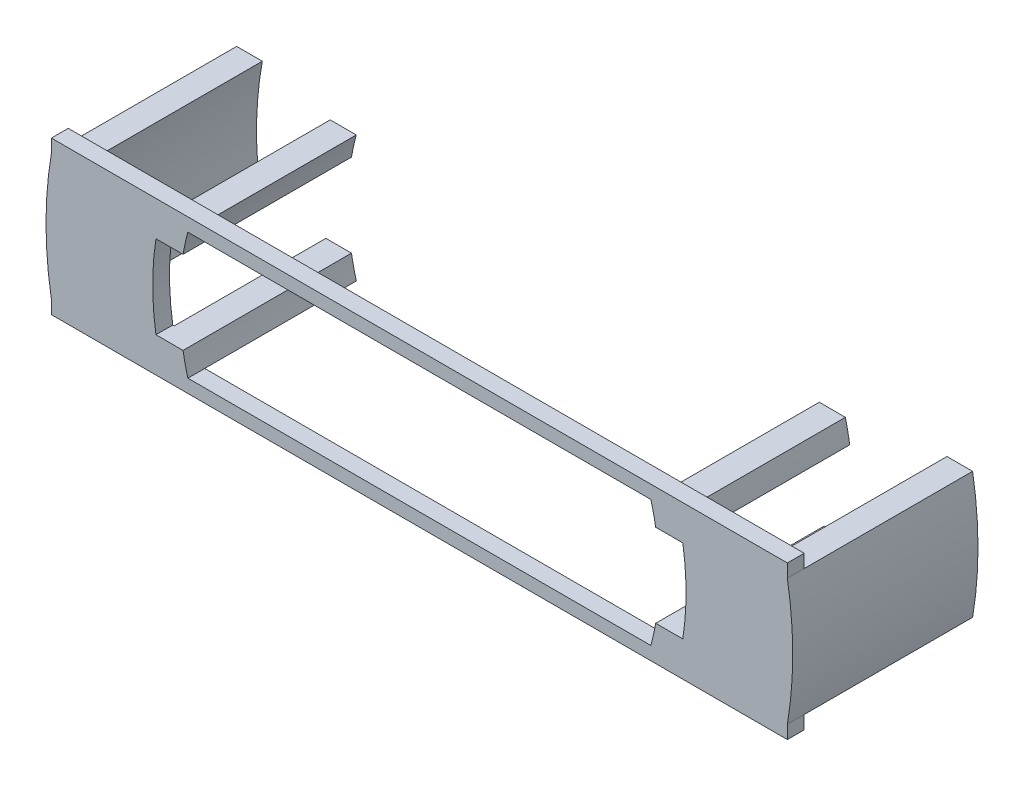
from build123d import *

# Parameters (mm, degrees)
BOSS_EXTRUDE1_DEPTH        = 2.54
BOSS_EXTRUDE1_DEPTH_BACK   = 25.4
BOSS_EXTRUDE1_2_DEPTH      = 2.54
BOSS_EXTRUDE1_2_DEPTH_BACK = 25.4
CUT_EXTRUDE1_DEPTH         = 38.1
SKETCH5_R                  = 52.5
SKETCH5_R_2                = 40
CUT_EXTRUDE2_DEPTH         = 63.505162797
SKETCH6_W                  = 110.993636282
SKETCH6_H                  = 2.54
BOSS_EXTRUDE2_DEPTH        = 2
SKETCH7_W                  = 110.993636282
SKETCH7_H                  = 2.54
BOSS_EXTRUDE3_DEPTH        = 2
SKETCH8_W                  = 85.612929722
SKETCH8_H                  = 41.20835684
CUT_EXTRUDE4_DEPTH         = 2.54


with BuildPart() as part:
    # Sketch1 → Boss-Extrude1 (new, two sides: drawn at the far end of the back side and taken through both)
    with BuildSketch(Plane.XY.offset(-BOSS_EXTRUDE1_DEPTH_BACK)):
        with BuildLine():
            Line((-55.496818141, -9.53516), (-34.911270727, -9.53516))
            ThreePointArc((-34.911270727, -9.53516), (-36.19, 0), (-34.911270727, 9.53516))
            Line((-34.911270727, 9.53516), (-55.496818141, 9.53516))
            ThreePointArc((-55.496818141, 9.53516), (-56.31, 0), (-55.496818141, -9.53516))
        make_face()
    extrude(amount=BOSS_EXTRUDE1_DEPTH + BOSS_EXTRUDE1_DEPTH_BACK)


with BuildPart() as body_2:
    # Sketch1 → Boss-Extrude1 2 (new, two sides: drawn at the far end of the back side and taken through both)
    with BuildSketch(Plane.XY.offset(-BOSS_EXTRUDE1_2_DEPTH_BACK)):
        with BuildLine():
            Line((55.496818141, 9.53516), (34.911270727, 9.53516))
            ThreePointArc((34.911270727, 9.53516), (36.19, 0), (34.911270727, -9.53516))
            Line((34.911270727, -9.53516), (55.496818141, -9.53516))
            ThreePointArc((55.496818141, -9.53516), (56.31, 0), (55.496818141, 9.53516))
        make_face()
    extrude(amount=BOSS_EXTRUDE1_2_DEPTH + BOSS_EXTRUDE1_2_DEPTH_BACK)


with BuildPart() as cut_extrude1_tool:
    # Sketch3 → Cut-Extrude1 (new body)
    with BuildSketch(Plane.XY.offset(2.54)):
        with BuildLine():
            Line((39.730552161, 6.27), (31.319999693, 6.27))
            ThreePointArc((31.319999693, 6.27), (31.941435171, 0), (31.319999693, -6.27))
            Line((31.319999693, -6.27), (39.730552161, -6.27))
            ThreePointArc((39.730552161, -6.27), (40.22225348, 0), (39.730552161, 6.27))
        make_face()
        with BuildLine():
            Line((-31.319999693, 6.27), (-39.730552161, 6.27))
            ThreePointArc((-39.730552161, 6.27), (-40.22225348, 0), (-39.730552161, -6.27))
            Line((-39.730552161, -6.27), (-31.319999693, -6.27))
            ThreePointArc((-31.319999693, -6.27), (-31.941435171, 0), (-31.319999693, 6.27))
        make_face()
    extrude(amount=-CUT_EXTRUDE1_DEPTH)


with BuildPart() as part_1:
    add(part.part)

    # Cut-Extrude1: cut by cut_extrude1_tool
    add(cut_extrude1_tool.part, mode=Mode.SUBTRACT)


with BuildPart() as body_2_1:
    add(body_2.part)

    # Cut-Extrude1: cut by cut_extrude1_tool
    add(cut_extrude1_tool.part, mode=Mode.SUBTRACT)


with BuildPart() as cut_extrude2_tool:
    # Sketch5 → Cut-Extrude2 (new, through all)
    with BuildSketch(Plane.XY):
        Circle(SKETCH5_R)
        Circle(SKETCH5_R_2, mode=Mode.SUBTRACT)
    extrude(amount=-CUT_EXTRUDE2_DEPTH)


with BuildPart() as part_2:
    add(part_1.part)

    # Cut-Extrude2: cut by cut_extrude2_tool
    add(cut_extrude2_tool.part, mode=Mode.SUBTRACT)



with BuildPart() as body_2_2:
    add(body_2_1.part)

    # Cut-Extrude2: cut by cut_extrude2_tool
    add(cut_extrude2_tool.part, mode=Mode.SUBTRACT)


with BuildPart() as part_3:
    add(part_2.part)

    add(body_2_2.part)  # Boss-Extrude2 merges body 2
    # Sketch6 → Boss-Extrude2 (add)
    with BuildSketch(Plane.XZ.offset(9.53516)):
        with Locations((0, 1.27)):
            Rectangle(SKETCH6_W, SKETCH6_H)
    extrude(amount=BOSS_EXTRUDE2_DEPTH)

    # Sketch7 → Boss-Extrude3 (add)
    with BuildSketch(Plane(origin=(0, 9.53516, 0), x_dir=(1, 0, 0), z_dir=(0, 1, 0))):
        with Locations((0, -1.27)):
            Rectangle(SKETCH7_W, SKETCH7_H)
    extrude(amount=BOSS_EXTRUDE3_DEPTH)

    # Sketch8 → Cut-Extrude4 (cut)
    with BuildSketch(Plane(origin=(0, 0, -25.4), x_dir=(-1, 0, 0), z_dir=(0, 0, -1))):
        Rectangle(SKETCH8_W, SKETCH8_H)
    extrude(amount=-CUT_EXTRUDE4_DEPTH, mode=Mode.SUBTRACT)


solid = part_3.part
